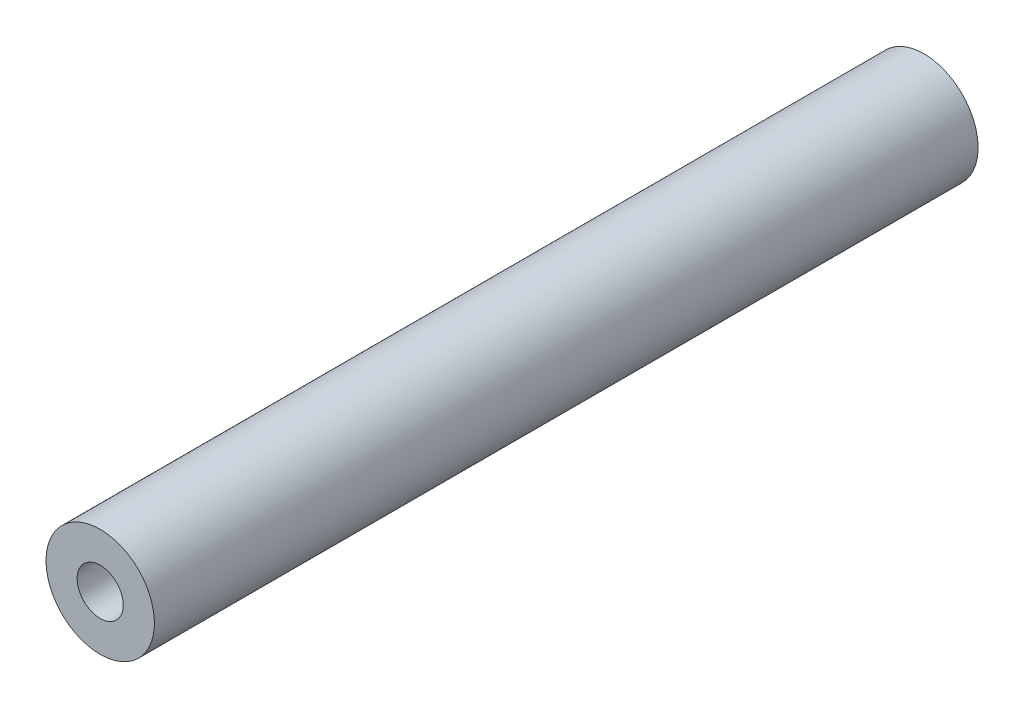
from build123d import *

# Parameters (mm, degrees)
SKETCH1_R           = 3.175
BOSS_EXTRUDE1_DEPTH = 48.26


with BuildPart() as part:
    # Sketch1 → Boss-Extrude1 (new body)
    with BuildSketch(Plane.XY):
        with Locations(Location((0, 0, 0), (0, 0, 180))):
            Circle(SKETCH1_R)
    extrude(amount=BOSS_EXTRUDE1_DEPTH)

    # Sketch4 → #6-32 Tapped Hole1 (revolve, cut)
    with BuildSketch(Plane(origin=(0, 0, 48.26), x_dir=(0, -1, 0), z_dir=(1, 0, 0))):
        Polygon((0, 0), (0, 13.51269403), (1.35255, 12.7), (1.35255, 0), align=None)
    f_6_32_tapped_hole1 = revolve(axis=Axis((0, 0, 54.61), (0, 0, -1)), mode=Mode.SUBTRACT)

    # Mirror1: #6-32 Tapped Hole1 across plane
    add(f_6_32_tapped_hole1.mirror(Plane.XY.offset(24.13)), mode=Mode.SUBTRACT)


solid = part.part
